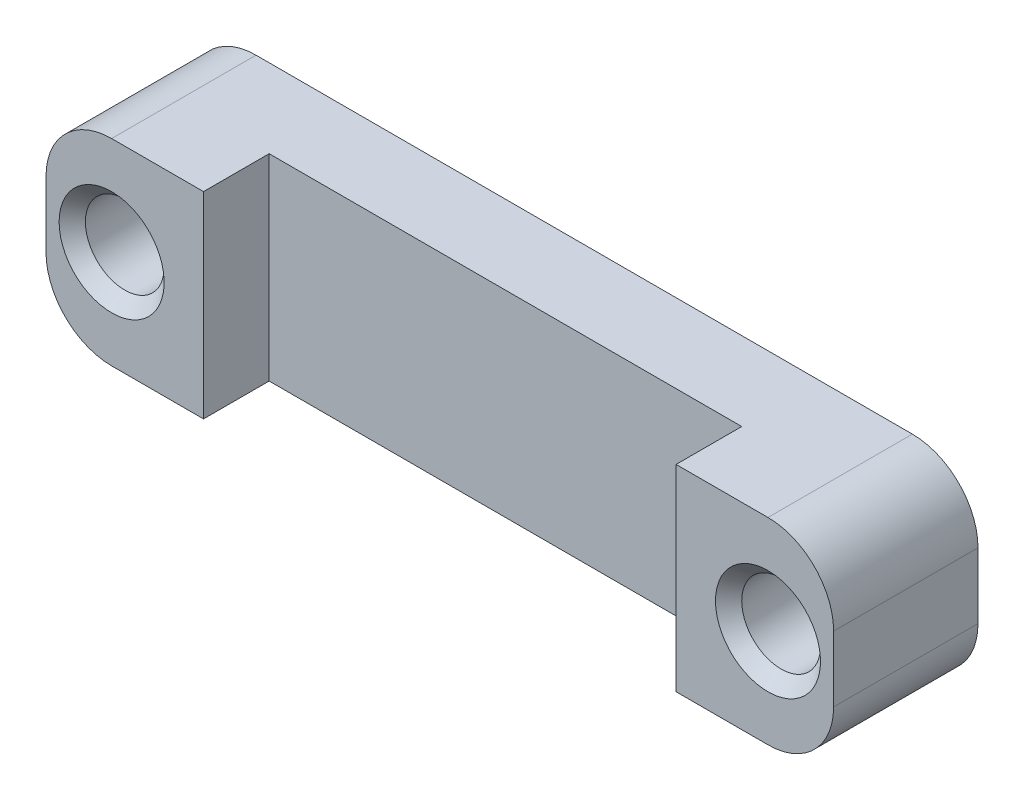
from build123d import *

# Parameters (mm, degrees)
CROQUIS1_W              = 60
CROQUIS1_H              = 15
CROQUIS1_R              = 3
SALIENTE_EXTRUIR1_DEPTH = 11
REDONDEO1_R             = 5
CORTAR_EXTRUIR1_DEPTH   = 21
CHAFL_N1_SIZE           = 1


with BuildPart() as part:
    # Croquis1 → Saliente-Extruir1 (new body)
    with BuildSketch(Plane.XY):
        with Locations((30, 7.5)):
            Rectangle(CROQUIS1_W, CROQUIS1_H)
        with Locations((5, 7.5)):
            Circle(CROQUIS1_R, mode=Mode.SUBTRACT)
        with Locations((55, 7.5)):
            Circle(CROQUIS1_R, mode=Mode.SUBTRACT)
    extrude(amount=SALIENTE_EXTRUIR1_DEPTH)

    # Redondeo1
    redondeo1_edges = [part.edges().sort_by_distance(p)[0] for p in [
        (0, 0, 5.5),
        (0, 15, 5.5),
        (60, 15, 5.5),
        (60, 0, 5.5),
    ]]
    fillet(redondeo1_edges, radius=REDONDEO1_R)

    # Croquis2 → Cortar-Extruir1 (cut)
    with BuildSketch(Plane(origin=(0, 15, 0), x_dir=(1, 0, 0), z_dir=(0, 1, 0))):
        Polygon((30, -11), (48, -11), (48, -6), (12, -6), (12, -11), align=None)
    extrude(amount=-CORTAR_EXTRUIR1_DEPTH, mode=Mode.SUBTRACT)

    # Chaflán1
    chafl_n1_edges = [part.edges().sort_by_distance(p)[0] for p in [
        (2, 7.5, 11),
        (52, 7.5, 11),
    ]]
    chamfer(chafl_n1_edges, length=CHAFL_N1_SIZE)


solid = part.part
